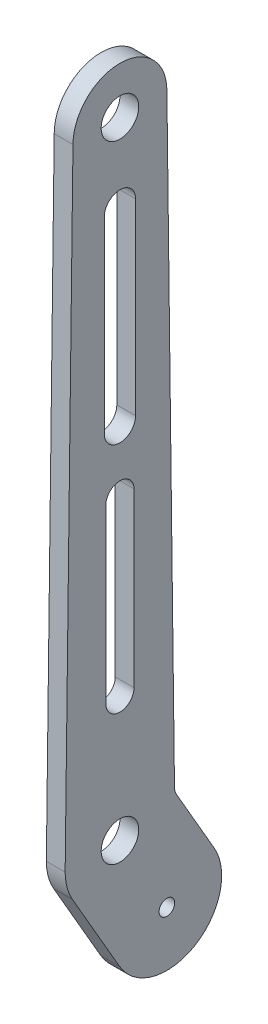
from build123d import *

# Parameters (mm, degrees)
SKETCH_1_R          = 6
EXTRUDE_1_DEPTH     = 6
CUT_EXTRUDE_1_DEPTH = 10
EXTRUDE_START       = -6
SKETCH_3_R          = 2.5
EXTRUDE_2_DEPTH     = 6
FILLET_2_R          = 5


with BuildPart() as part:
    # 草图1 → 凸台-拉伸1 (new body)
    with BuildSketch(Plane(origin=(0, 0, 0), x_dir=(0, 0, -1), z_dir=(1, 0, 0))):
        with BuildLine():
            Line((15, 0), (17.5, -200))
            ThreePointArc((17.5, -200), (0, -217.5), (-17.5, -200))
            Line((-17.5, -200), (-15, 0))
            ThreePointArc((-15, 0), (0, 15), (15, 0))
        make_face()
        Circle(SKETCH_1_R, mode=Mode.SUBTRACT)
        with Locations((0, -200)):
            Circle(SKETCH_1_R, mode=Mode.SUBTRACT)
    extrude(amount=EXTRUDE_1_DEPTH)

    # 草图2 → 切除-拉伸1 (cut)
    with BuildSketch(Plane(origin=(6, 0, 0), x_dir=(0, 0, -1), z_dir=(1, 0, 0))):
        with BuildLine():
            Line((5, -25), (5, -85))
            ThreePointArc((5, -85), (0, -90), (-5, -85))
            Line((-5, -85), (-5, -25))
            ThreePointArc((-5, -25), (0, -20), (5, -25))
        make_face()
        with BuildLine():
            Line((4.5, -105), (4.5, -160))
            ThreePointArc((4.5, -160), (0, -164.5), (-4.5, -160))
            Line((-4.5, -160), (-4.5, -105))
            ThreePointArc((-4.5, -105), (0, -100.5), (4.5, -105))
        make_face()
    extrude(amount=-CUT_EXTRUDE_1_DEPTH, mode=Mode.SUBTRACT)

    # 草图3 → 凸台-拉伸2 (add)
    with BuildSketch(Plane(origin=(6, 0, 0), x_dir=(0, 0, -1), z_dir=(1, 0, 0)).offset(EXTRUDE_START)):
        with BuildLine():
            Line((-15.155444566, -208.75), (-0.155444566, -234.730762114))
            ThreePointArc((-0.155444566, -234.730762114), (23.75, -241.13620668), (30.155444566, -217.230762114))
            Line((30.155444566, -217.230762114), (17.440089003, -195.207120242))
            Line((17.440089003, -195.207120242), (17.494532104, -199.562568349))
            ThreePointArc((17.494532104, -199.562568349), (15.263627142, -208.559888228), (8.75, -215.155444566))
            ThreePointArc((8.75, -215.155444566), (-4.529333289, -216.90370196), (-15.155444566, -208.75))
        make_face()
        with Locations((15, -225.980762114)):
            Circle(SKETCH_3_R, mode=Mode.SUBTRACT)
    extrude(amount=EXTRUDE_2_DEPTH)

    # 圆角2
    fillet_2_edges = [part.edges().sort_by_distance(p)[0] for p in [
        (3, -195.207120242, -17.440089003),
    ]]
    fillet(fillet_2_edges, radius=FILLET_2_R)


solid = part.part
